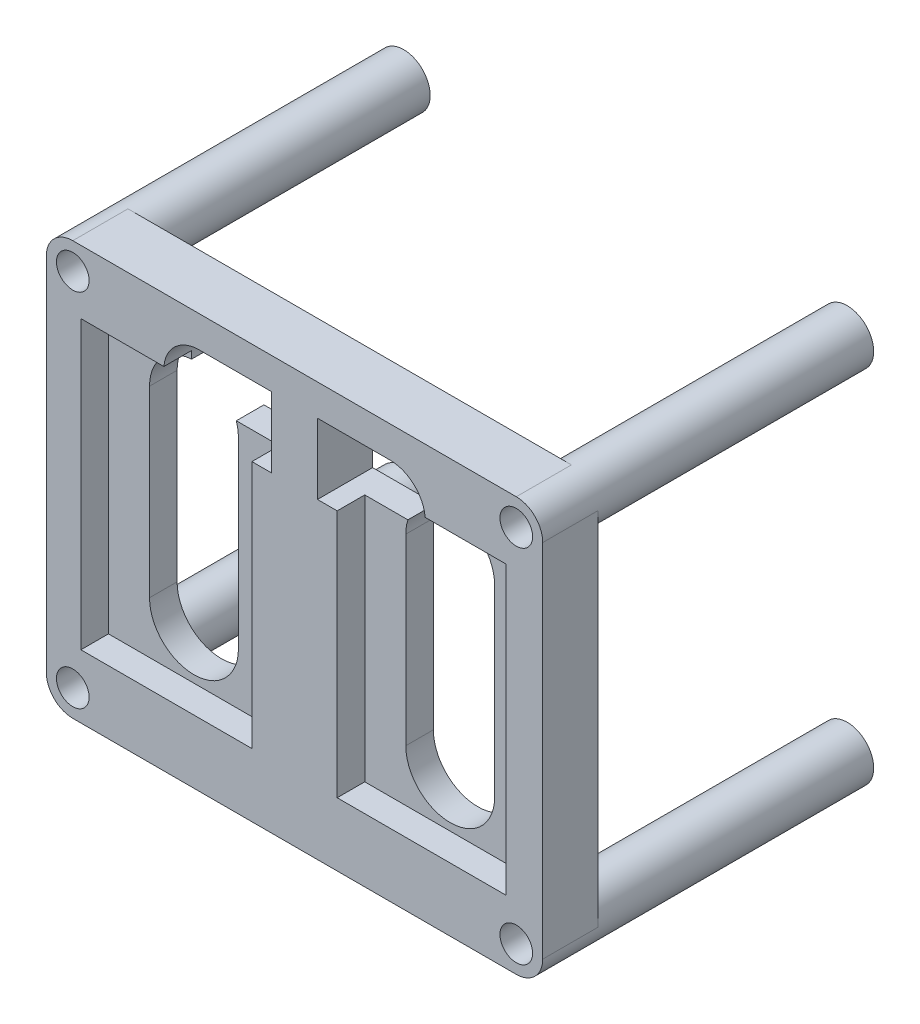
from build123d import *

# Parameters (mm, degrees)
EXTRUDE_1_DEPTH          = 20
EXTRUDE_2_DEPTH          = 10
EXTRUDE_3_DEPTH          = 20
CUT_EXTRUDE_4_DEPTH      = 5
EXTRUDE_START            = -100
SKETCH_1_11_R            = 9.592658998
SKETCH_1_11_R_2          = 5.923282924
EXTRUDE_5_DEPTH          = 100
EXTRUDE_5_2_DEPTH        = 100
EXTRUDE_5_3_DEPTH        = 100
EXTRUDE_5_4_DEPTH        = 100
CUT_EXTRUDE_5_DEPTH      = 155.029218007
CUT_EXTRUDE_5_DEPTH_BACK = 12
SKETCH_1_15_R            = 9.592658998
SKETCH_1_15_R_2          = 5.923282924
EXTRUDE_7_DEPTH          = 20


with BuildPart() as part:
    # 草图1 → 凸台-拉伸1 (new body)
    with BuildSketch(Plane.XY):
        with BuildLine():
            Line((80.407341002, 75), (-80.407341002, 75))
            ThreePointArc((-80.407341002, 75), (-73.624306776, 72.190375229), (-70.814682005, 65.407341002))
            ThreePointArc((-70.814682005, 65.407341002), (-80.407341002, 55.814682005), (-90, 65.407341002))
            Line((-90, 65.407341002), (-90, -65.407341002))
            ThreePointArc((-90, -65.407341002), (-80.407341002, -55.814682005), (-70.814682005, -65.407341002))
            ThreePointArc((-70.814682005, -65.407341002), (-73.624306776, -72.190375229), (-80.407341002, -75))
            Line((-80.407341002, -75), (80.407341002, -75))
            ThreePointArc((80.407341002, -75), (73.624306776, -58.624306776), (90, -65.407341002))
            Line((90, -65.407341002), (90, 65.407341002))
            ThreePointArc((90, 65.407341002), (73.624306776, 58.624306776), (80.407341002, 75))
        make_face()
        with BuildLine():
            Line((-77.463981191, -52), (-77.463981191, 52))
            Line((-77.463981191, 52), (-47.378758628, 52))
            ThreePointArc((-47.378758628, 52), (-43.279624238, 60.276513692), (-34.66969867, 63.619082069))
            Line((-34.66969867, 63.619082069), (-8.32333029, 63.619082069))
            ThreePointArc((-8.32333029, 63.619082069), (0, 71.942412359), (8.32333029, 63.619082069))
            Line((8.32333029, 63.619082069), (34.66969867, 63.619082069))
            ThreePointArc((34.66969867, 63.619082069), (43.279624238, 60.276513692), (47.378758628, 52))
            Line((47.378758628, 52), (76.756459617, 52))
            Line((76.756459617, 52), (76.756459617, -52))
            Line((76.756459617, -52), (15.463981191, -52))
            Line((15.463981191, -52), (15.463981191, 38.098712095))
            Line((15.463981191, 38.098712095), (8.32333029, 38.098712095))
            ThreePointArc((8.32333029, 38.098712095), (0, 29.775381805), (-8.32333029, 38.098712095))
            Line((-8.32333029, 38.098712095), (-15.463981191, 38.098712095))
            Line((-15.463981191, 38.098712095), (-15.463981191, -52))
            Line((-15.463981191, -52), (-77.463981191, -52))
        make_face(mode=Mode.SUBTRACT)
    extrude(amount=EXTRUDE_1_DEPTH)

    # 草图1<3> → 凸台-拉伸2 (add)
    with BuildSketch(Plane.XY):
        with BuildLine():
            Line((-47.378758628, 52), (-77.463981191, 52))
            Line((-77.463981191, 52), (-77.463981191, -52))
            Line((-77.463981191, -52), (-15.463981191, -52))
            Line((-15.463981191, -52), (-15.463981191, 38.098712095))
            Line((-15.463981191, 38.098712095), (-31.105836296, 38.098712095))
            ThreePointArc((-31.105836296, 38.098712095), (-30.538825138, 35.686508189), (-30.348320097, 33.215893454))
            Line((-30.348320097, 33.215893454), (-30.348320097, -33.215893454))
            ThreePointArc((-30.348320097, -33.215893454), (-46.463981191, -49.331554547), (-62.579642285, -33.215893454))
            Line((-62.579642285, -33.215893454), (-62.579642285, 33.215893454))
            ThreePointArc((-62.579642285, 33.215893454), (-58.163470775, 44.299055275), (-47.335281505, 49.307983692))
            ThreePointArc((-47.335281505, 49.307983692), (-47.428219829, 50.652841942), (-47.378758628, 52))
        make_face()
        with BuildLine():
            Line((31.105836296, 38.098712095), (15.463981191, 38.098712095))
            Line((15.463981191, 38.098712095), (15.463981191, -52))
            Line((15.463981191, -52), (76.756459617, -52))
            Line((76.756459617, -52), (76.756459617, 52))
            Line((76.756459617, 52), (47.378758628, 52))
            ThreePointArc((47.378758628, 52), (47.428219829, 50.652841942), (47.335281505, 49.307983692))
            ThreePointArc((47.335281505, 49.307983692), (58.163470775, 44.299055275), (62.579642285, 33.215893454))
            Line((62.579642285, 33.215893454), (62.579642285, -33.215893454))
            ThreePointArc((62.579642285, -33.215893454), (46.463981191, -49.331554547), (30.348320097, -33.215893454))
            Line((30.348320097, -33.215893454), (30.348320097, 33.215893454))
            ThreePointArc((30.348320097, 33.215893454), (30.538825138, 35.686508189), (31.105836296, 38.098712095))
        make_face()
    extrude(amount=EXTRUDE_2_DEPTH)

    # 草图1<4> → 凸台-拉伸3 (add)
    with BuildSketch(Plane.XY):
        with BuildLine():
            ThreePointArc((-34.66969867, 63.619082069), (-47.429883657, 50.858897082), (-34.66969867, 38.098712095))
            Line((-34.66969867, 38.098712095), (-8.32333029, 38.098712095))
            Line((-8.32333029, 38.098712095), (-8.32333029, 63.619082069))
            Line((-8.32333029, 63.619082069), (-34.66969867, 63.619082069))
        make_face()
        with BuildLine():
            Line((34.66969867, 63.619082069), (8.32333029, 63.619082069))
            Line((8.32333029, 63.619082069), (8.32333029, 38.098712095))
            Line((8.32333029, 38.098712095), (34.66969867, 38.098712095))
            ThreePointArc((34.66969867, 38.098712095), (47.429883657, 50.858897082), (34.66969867, 63.619082069))
        make_face()
    extrude(amount=EXTRUDE_3_DEPTH)

    # 草图1<8> → 切除-拉伸4 (cut, symmetric)
    with BuildSketch(Plane.XY):
        with BuildLine():
            ThreePointArc((-34.66969867, 63.619082069), (-47.429883657, 50.858897082), (-34.66969867, 38.098712095))
            Line((-34.66969867, 38.098712095), (-8.32333029, 38.098712095))
            Line((-8.32333029, 38.098712095), (-8.32333029, 63.619082069))
            Line((-8.32333029, 63.619082069), (-34.66969867, 63.619082069))
        make_face()
        with BuildLine():
            Line((34.66969867, 63.619082069), (8.32333029, 63.619082069))
            Line((8.32333029, 63.619082069), (8.32333029, 38.098712095))
            Line((8.32333029, 38.098712095), (34.66969867, 38.098712095))
            ThreePointArc((34.66969867, 38.098712095), (47.429883657, 50.858897082), (34.66969867, 63.619082069))
        make_face()
    extrude(amount=CUT_EXTRUDE_4_DEPTH, both=True, mode=Mode.SUBTRACT)

    # 草图1<14> → 切除-拉伸5 (cut, two sides: drawn at the far end of the back side and taken through both)
    with BuildSketch(Plane.XY.offset(-CUT_EXTRUDE_5_DEPTH_BACK)):
        with BuildLine():
            ThreePointArc((-34.66969867, 63.619082069), (-47.429883657, 50.858897082), (-34.66969867, 38.098712095))
            Line((-34.66969867, 38.098712095), (-8.32333029, 38.098712095))
            Line((-8.32333029, 38.098712095), (-8.32333029, 63.619082069))
            Line((-8.32333029, 63.619082069), (-34.66969867, 63.619082069))
        make_face()
        with BuildLine():
            Line((34.66969867, 63.619082069), (8.32333029, 63.619082069))
            Line((8.32333029, 63.619082069), (8.32333029, 38.098712095))
            Line((8.32333029, 38.098712095), (34.66969867, 38.098712095))
            ThreePointArc((34.66969867, 38.098712095), (47.429883657, 50.858897082), (34.66969867, 63.619082069))
        make_face()
    extrude(amount=CUT_EXTRUDE_5_DEPTH + CUT_EXTRUDE_5_DEPTH_BACK, mode=Mode.SUBTRACT)



with BuildPart() as body_2:
    # 草图1<11> → 凸台-拉伸5 (new body)
    with BuildSketch(Plane.XY.offset(EXTRUDE_START)):
        with Locations((-80.407341002, 65.407341002)):
            Circle(SKETCH_1_11_R)
        with Locations((-80.407341002, 65.407341002)):
            Circle(SKETCH_1_11_R_2, mode=Mode.SUBTRACT)
    extrude(amount=EXTRUDE_5_DEPTH)


with BuildPart() as body_3:
    # 草图1<11> → Extrude 5 2 (new body)
    with BuildSketch(Plane.XY.offset(EXTRUDE_START)):
        with Locations((80.407341002, 65.407341002)):
            Circle(SKETCH_1_11_R)
        with Locations((80.407341002, 65.407341002)):
            Circle(SKETCH_1_11_R_2, mode=Mode.SUBTRACT)
    extrude(amount=EXTRUDE_5_2_DEPTH)


with BuildPart() as body_4:
    # 草图1<11> → Extrude 5 3 (new body)
    with BuildSketch(Plane.XY.offset(EXTRUDE_START)):
        with Locations((-80.407341002, -65.407341002)):
            Circle(SKETCH_1_11_R)
        with Locations((-80.407341002, -65.407341002)):
            Circle(SKETCH_1_11_R_2, mode=Mode.SUBTRACT)
    extrude(amount=EXTRUDE_5_3_DEPTH)


with BuildPart() as body_5:
    # 草图1<11> → Extrude 5 4 (new body)
    with BuildSketch(Plane.XY.offset(EXTRUDE_START)):
        with Locations((80.407341002, -65.407341002)):
            Circle(SKETCH_1_11_R)
        with Locations((80.407341002, -65.407341002)):
            Circle(SKETCH_1_11_R_2, mode=Mode.SUBTRACT)
    extrude(amount=EXTRUDE_5_4_DEPTH)


with BuildPart() as part_1:
    add(part.part)

    add(body_2.part)  # 凸台-拉伸7 merges body 2

    add(body_3.part)  # 凸台-拉伸7 merges body 3

    add(body_4.part)  # 凸台-拉伸7 merges body 4

    add(body_5.part)  # 凸台-拉伸7 merges body 5
    # 草图1<15> → 凸台-拉伸7 (add)
    # profile 1 of 5: a face of its own
    with BuildSketch(Plane.XY):
        with Locations((-80.407341002, 65.407341002)):
            Circle(SKETCH_1_15_R)
        with Locations((-80.407341002, 65.407341002)):
            Circle(SKETCH_1_15_R_2, mode=Mode.SUBTRACT)
    # profile 2 of 5: a face of its own
    with BuildSketch(Plane.XY):
        with Locations((80.407341002, 65.407341002)):
            Circle(SKETCH_1_15_R)
        with Locations((80.407341002, 65.407341002)):
            Circle(SKETCH_1_15_R_2, mode=Mode.SUBTRACT)
    # profile 3 of 5: a face of its own
    with BuildSketch(Plane.XY):
        with Locations((-80.407341002, -65.407341002)):
            Circle(SKETCH_1_15_R)
        with Locations((-80.407341002, -65.407341002)):
            Circle(SKETCH_1_15_R_2, mode=Mode.SUBTRACT)
    # profile 4 of 5: a face of its own
    with BuildSketch(Plane.XY):
        with Locations((80.407341002, -65.407341002)):
            Circle(SKETCH_1_15_R)
        with Locations((80.407341002, -65.407341002)):
            Circle(SKETCH_1_15_R_2, mode=Mode.SUBTRACT)
    # profile 5 of 5: a face of its own
    with BuildSketch(Plane.XY):
        with BuildLine():
            ThreePointArc((8.32333029, 63.619082069), (0, 71.942412359), (-8.32333029, 63.619082069))
            Line((-8.32333029, 63.619082069), (-8.32333029, 38.098712095))
            ThreePointArc((-8.32333029, 38.098712095), (0, 29.775381805), (8.32333029, 38.098712095))
            Line((8.32333029, 38.098712095), (8.32333029, 63.619082069))
        make_face()
    extrude(amount=EXTRUDE_7_DEPTH)


solid = part_1.part
